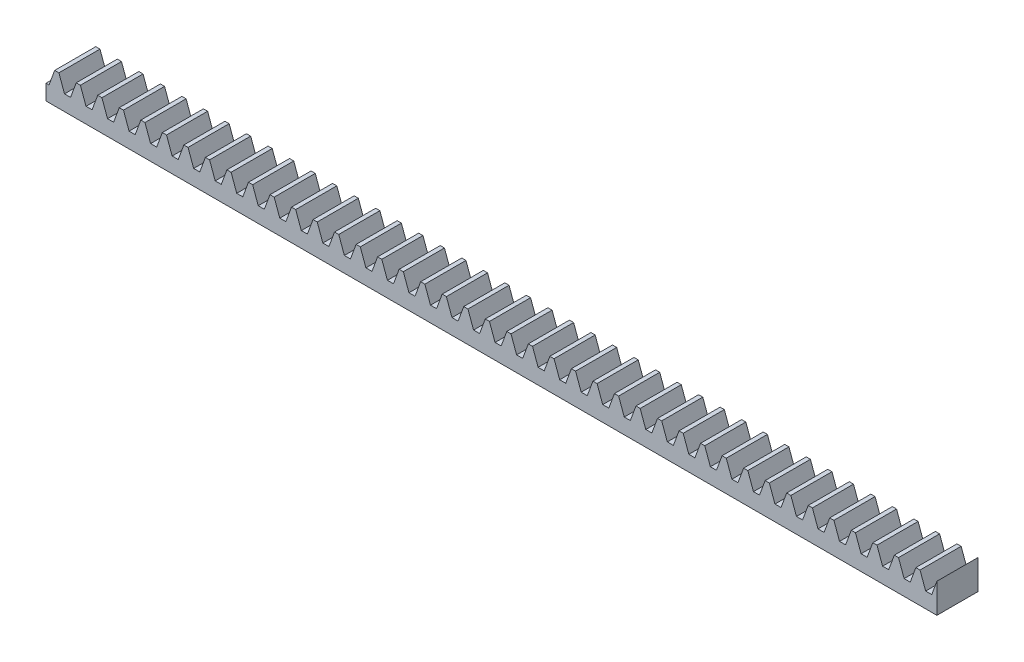
from build123d import *

# Parameters (mm, degrees)
BLANKSKE_W        = 130
BLANKSKE_H        = 4.5
BLANK_DEPTH       = 6
TOOTHCUTSIM_DEPTH = 131.216166431
TEETHCUTS_COUNT   = 42
TEETHCUTS_PITCH   = 3.14159265


with BuildPart() as part:
    # BlankSke → Blank (new body)
    with BuildSketch(Plane.XY):
        with Locations((65, 2.25)):
            Rectangle(BLANKSKE_W, BLANKSKE_H)
    extrude(amount=-BLANK_DEPTH)

    # TooCutSkeSim → ToothCutSim (cut, through all)
    with BuildSketch(Plane.XY):
        Polygon((0.44443537, 2.25), (-0.44443537, 2.25), (-1.272613241, 4.5254), (1.272613241, 4.5254), align=None)
    toothcutsim = extrude(amount=-TOOTHCUTSIM_DEPTH, mode=Mode.SUBTRACT)

    # TeethCuts: ToothCutSim ×42
    with Locations(*[(i * TEETHCUTS_PITCH, 0, 0) for i in range(1, TEETHCUTS_COUNT)]):
        add(toothcutsim, mode=Mode.SUBTRACT)


solid = part.part
